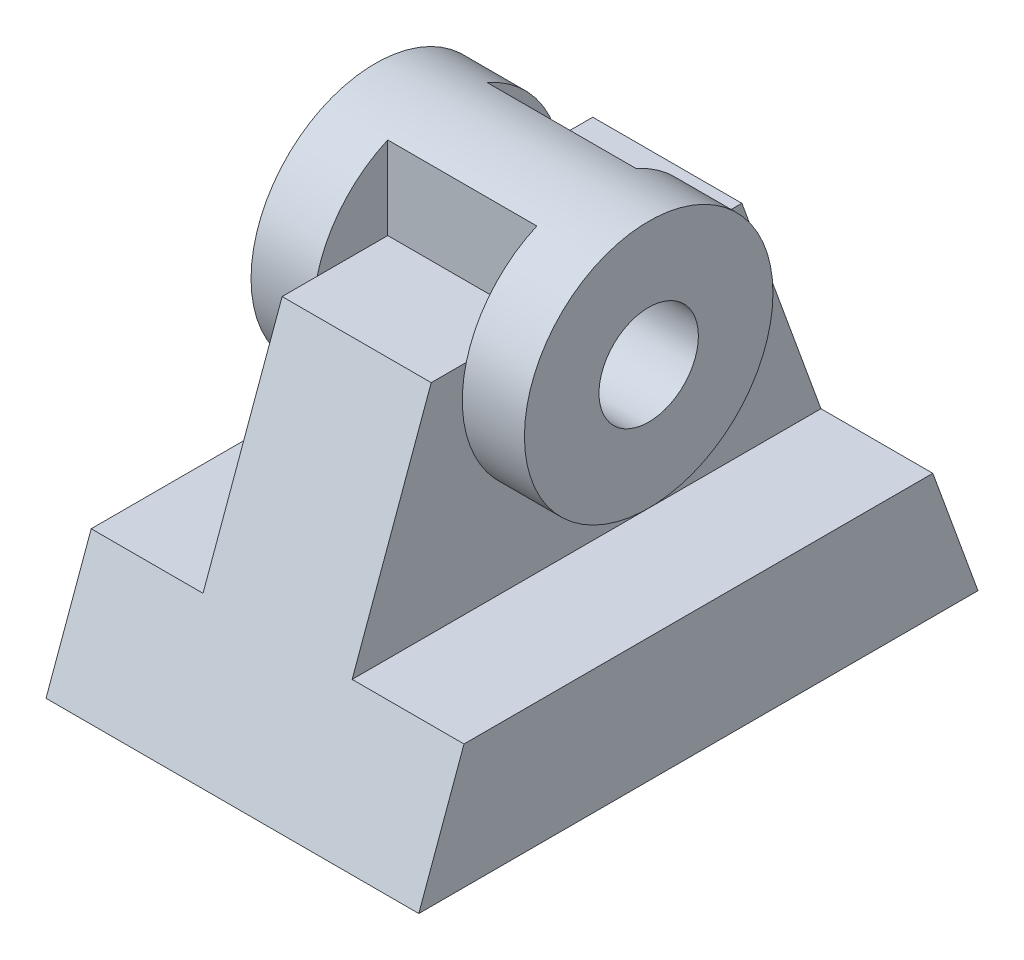
from build123d import *

# Parameters (mm, degrees)
SALIENTE_EXTRUIR1_DEPTH    = 30
CROQUIS2_W                 = 18
CROQUIS2_H                 = 35
CORTAR_EXTRUIR1_DEPTH      = 110.658560997
CROQUIS3_R                 = 20
SALIENTE_EXTRUIR2_DEPTH    = 22
CORTAR_EXTRUIR2_DEPTH      = 89.459030065
CORTAR_EXTRUIR2_DEPTH_BACK = 89.459030065
CROQUIS3_3_R               = 8
CROQUIS4_W                 = 24
CROQUIS4_H                 = 17
CORTAR_EXTRUIR4_DEPTH      = 15


with BuildPart() as part:
    # Croquis1 → Saliente-Extruir1 (new, symmetric)
    with BuildSketch(Plane(origin=(0, 0, 0), x_dir=(0, 0, -1), z_dir=(1, 0, 0))):
        Polygon((45, 0), (-45, 0), (-25, 55), (25, 55), align=None)
    extrude(amount=SALIENTE_EXTRUIR1_DEPTH, both=True)

    # Croquis2 → Cortar-Extruir1 (cut, through all)
    with BuildSketch(Plane.XY.offset(45)):
        with Locations((-21, 37.5)):
            Rectangle(CROQUIS2_W, CROQUIS2_H)
        with Locations((21, 37.5)):
            Rectangle(CROQUIS2_W, CROQUIS2_H)
    extrude(amount=-CORTAR_EXTRUIR1_DEPTH, mode=Mode.SUBTRACT)

    # Croquis3 → Saliente-Extruir2 (add, symmetric)
    with BuildSketch(Plane(origin=(0, 0, 0), x_dir=(0, 0, -1), z_dir=(1, 0, 0))):
        with Locations((0, 50)):
            Circle(CROQUIS3_R)
    extrude(amount=SALIENTE_EXTRUIR2_DEPTH, both=True)

    # Croquis3<3> → Cortar-Extruir2 (cut, two sides: drawn at the far end of the back side and taken through both)
    with BuildSketch(Plane(origin=(0, 0, 0), x_dir=(0, 0, -1), z_dir=(1, 0, 0)).offset(-CORTAR_EXTRUIR2_DEPTH_BACK)):
        with Locations((0, 50)):
            Circle(CROQUIS3_3_R)
    extrude(amount=CORTAR_EXTRUIR2_DEPTH + CORTAR_EXTRUIR2_DEPTH_BACK, mode=Mode.SUBTRACT)

    # Croquis4 → Cortar-Extruir4 (cut)
    with BuildSketch(Plane(origin=(0, 70, 0), x_dir=(1, 0, 0), z_dir=(0, 1, 0))):
        with Locations((0, -16.5)):
            Rectangle(CROQUIS4_W, CROQUIS4_H)
        with Locations((0, 16.5)):
            Rectangle(CROQUIS4_W, CROQUIS4_H)
    extrude(amount=-CORTAR_EXTRUIR4_DEPTH, mode=Mode.SUBTRACT)


solid = part.part
